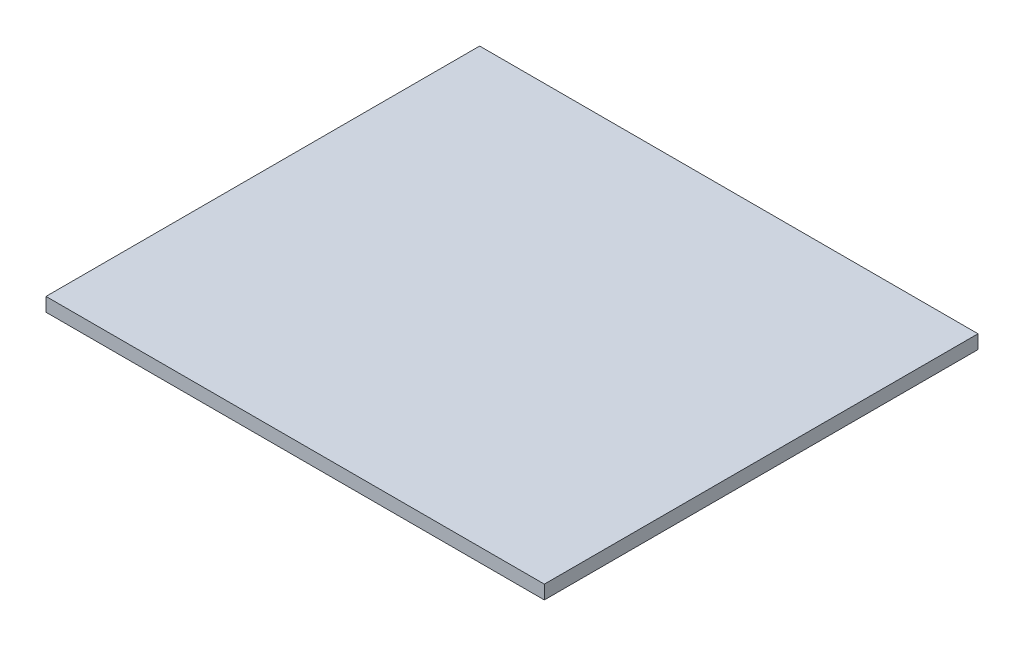
from build123d import *

# Parameters (mm, degrees)
SKETCH1_W           = 354.00488
SKETCH1_H           = 308.0512
BOSS_EXTRUDE1_DEPTH = 9.7536


with BuildPart() as part:
    # Sketch1 → Boss-Extrude1 (new body)
    with BuildSketch(Plane(origin=(0, 0, 0), x_dir=(1, 0, 0), z_dir=(0, 1, 0))):
        with Locations((-22.236704585, -117.108467707)):
            Rectangle(SKETCH1_W, SKETCH1_H)
    extrude(amount=BOSS_EXTRUDE1_DEPTH)


solid = part.part
